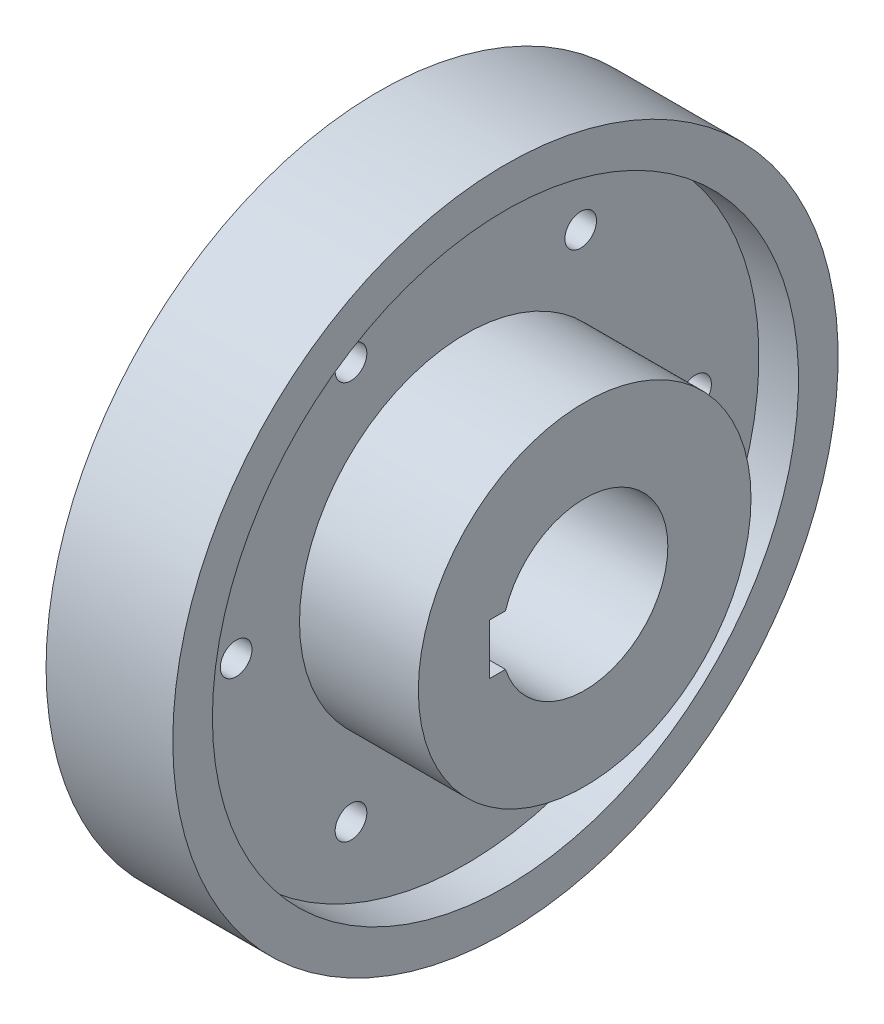
from build123d import *

# Parameters (mm, degrees)
SKETCH3_R               = 10
CUT_EXTRUDE1_DEPTH      = 307.30866785
CIRPATTERN1_COUNT       = 6
SKETCH5_R               = 100
BOSS_EXTRUDE1_DEPTH     = 10
CUT_EXTRUDE2_DEPTH      = 325.191301549
CUT_EXTRUDE2_DEPTH_BACK = 325.191301549
SKETCH4_W               = 32
SKETCH4_H               = 10
CUT_EXTRUDE4_DEPTH      = 329.329103188
CUT_EXTRUDE4_DEPTH_BACK = 329.329103188
SKETCH6_R               = 52.5


with BuildPart() as part:
    # Sketch2 → Revolve1 (revolve)
    with BuildSketch(Plane(origin=(0, 0, 0), x_dir=(-1, 0, 0), z_dir=(0, 1, 0))):
        Polygon((-138.434782609, 52.5), (-268.434782609, 52.5), (-268.434782609, 105), (-193.434782609, 105), (-193.434782609, 185), (-218.434782609, 185), (-218.434782609, 210), (-138.434782609, 210), align=None)
    revolve(axis=Axis((0, 0, 0), (1, 0, 0)))

    # Sketch3 → Cut-Extrude1 (cut, through all)
    with BuildSketch(Plane.YZ.offset(193.434782609)):
        with Locations(Location((0, 145, 0), (0, 0, 270))):
            Circle(SKETCH3_R)
    cut_extrude1 = extrude(amount=-CUT_EXTRUDE1_DEPTH, mode=Mode.SUBTRACT)

    # CirPattern1: Cut-Extrude1 ×6 about axis
    cirpattern1_axis = Axis((0, 0, 0), (1, 0, 0))
    for i in range(1, CIRPATTERN1_COUNT):
        add(cut_extrude1.rotate(cirpattern1_axis, i * 360 / CIRPATTERN1_COUNT), mode=Mode.SUBTRACT)

    # Sketch5 → Boss-Extrude1 (add)
    with BuildSketch(Plane(origin=(138.434782609, 0, 0), x_dir=(0, -1, 0), z_dir=(-1, 0, 0))):
        with Locations(Location((0, 0, 0), (0, 0, 90))):
            Circle(SKETCH5_R)
    extrude(amount=BOSS_EXTRUDE1_DEPTH)

    # Sketch4 → Cut-Extrude2 (cut, two sides: drawn at the far end of the back side and taken through both)
    with BuildSketch(Plane(origin=(138.434782609, 0, 0), x_dir=(0, -1, 0), z_dir=(-1, 0, 0)).offset(-CUT_EXTRUDE2_DEPTH_BACK)):
        with Locations((0, 55.002499938)):
            Rectangle(SKETCH4_W, SKETCH4_H)
    extrude(amount=CUT_EXTRUDE2_DEPTH + CUT_EXTRUDE2_DEPTH_BACK, mode=Mode.SUBTRACT)

    # Sketch6 → Cut-Extrude4 (cut, two sides: drawn at the far end of the back side and taken through both)
    with BuildSketch(Plane(origin=(128.434782609, 0, 0), x_dir=(0, -1, 0), z_dir=(-1, 0, 0)).offset(-CUT_EXTRUDE4_DEPTH_BACK)):
        Circle(SKETCH6_R)
    extrude(amount=CUT_EXTRUDE4_DEPTH + CUT_EXTRUDE4_DEPTH_BACK, mode=Mode.SUBTRACT)


solid = part.part
